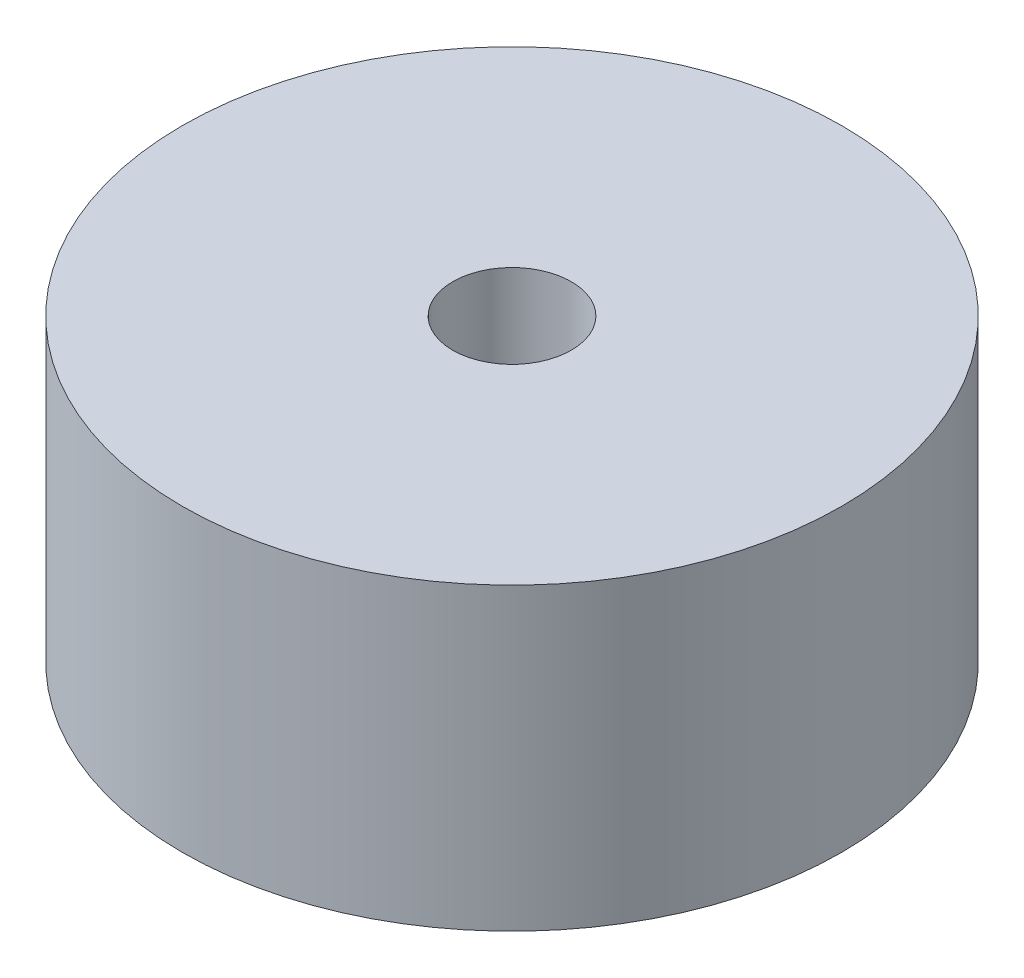
from build123d import *

# Parameters (mm, degrees)
SKETCH1_R           = 5.5
SKETCH1_R_2         = 0.99
BOSS_EXTRUDE1_DEPTH = 5


with BuildPart() as part:
    # Sketch1 → Boss-Extrude1 (new body)
    with BuildSketch(Plane(origin=(0, 0, 0), x_dir=(1, 0, 0), z_dir=(0, 1, 0))):
        with Locations(Location((0, 0, 0), (0, 0, 270))):
            Circle(SKETCH1_R)
        with Locations(Location((0, 0, 0), (0, 0, 270))):
            Circle(SKETCH1_R_2, mode=Mode.SUBTRACT)
    extrude(amount=BOSS_EXTRUDE1_DEPTH)


solid = part.part
